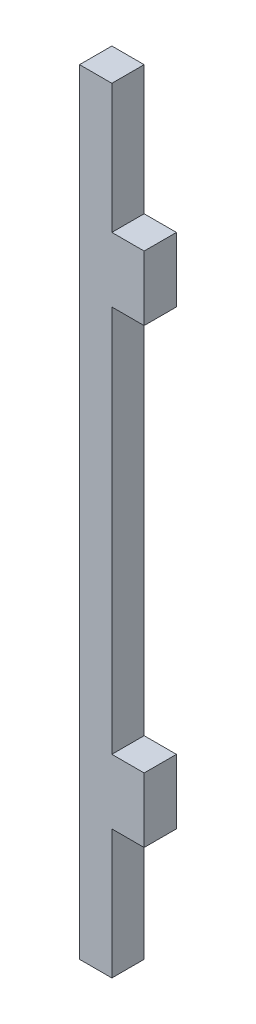
from build123d import *

# Parameters (mm, degrees)
BOSS_EXTRU_1_DEPTH = 5


with BuildPart() as part:
    # Esquisse1 → Boss.-Extru.1 (new body)
    with BuildSketch(Plane.XY):
        Polygon((0, 0), (-5, 0), (-5, 120), (0, 120), (0, 100), (5, 100), (5, 90), (0, 90), (0, 30), (5, 30), (5, 20), (0, 20), align=None)
    extrude(amount=BOSS_EXTRU_1_DEPTH)


solid = part.part
